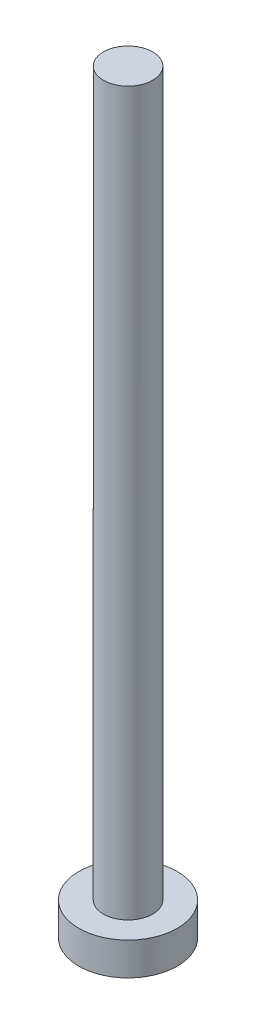
from build123d import *

# Parameters (mm, degrees)
SKETCH1_R           = 1.5
BOSS_EXTRUDE1_DEPTH = 46
SKETCH2_R           = 3
BOSS_EXTRUDE2_DEPTH = 2


with BuildPart() as part:
    # Sketch1 → Boss-Extrude1 (new body)
    with BuildSketch(Plane(origin=(0, 0, 0), x_dir=(1, 0, 0), z_dir=(0, 1, 0))):
        with Locations(Location((0, 0, 0), (0, 0, 270))):
            Circle(SKETCH1_R)
    extrude(amount=BOSS_EXTRUDE1_DEPTH)

    # Sketch2 → Boss-Extrude2 (add)
    with BuildSketch(Plane.XZ):
        with Locations(Location((0, 0, 0), (0, 0, 270))):
            Circle(SKETCH2_R)
    extrude(amount=-BOSS_EXTRUDE2_DEPTH)


solid = part.part
